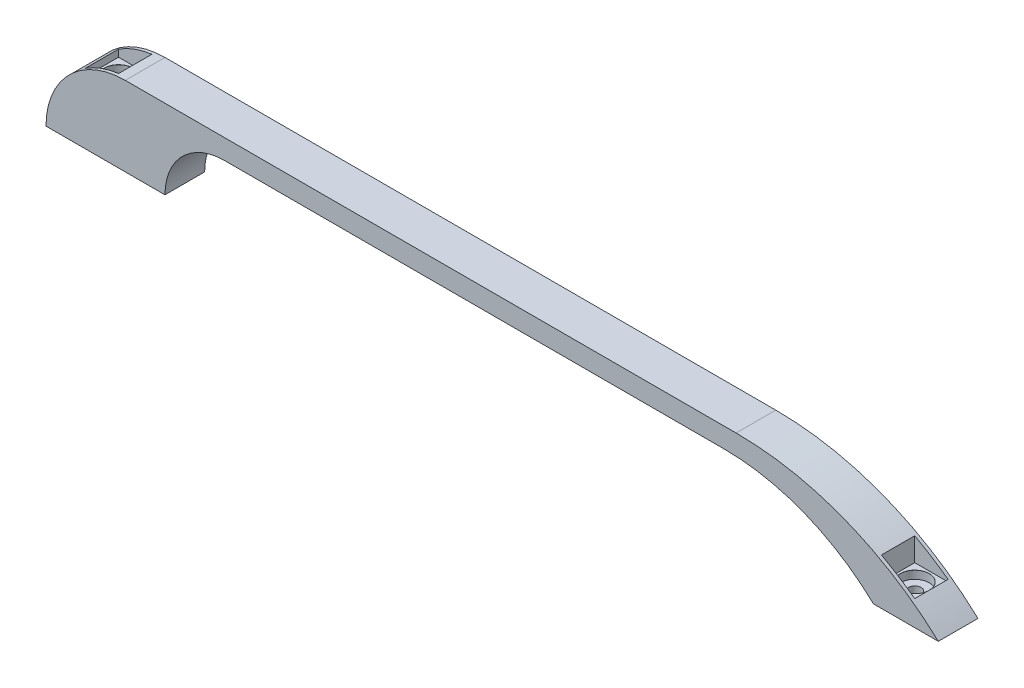
from build123d import *

# Parameters (mm, degrees)
DODANIE_WYCI_GNI_CIE2_DEPTH = 20
SZKIC28_W                   = 16.8
SZKIC28_H                   = 16.8
WYTNIJ_WYCI_GNI_CIE1_DEPTH  = 20
SZKIC29_W                   = 16.8
SZKIC29_H                   = 16.8
WYTNIJ_WYCI_GNI_CIE2_DEPTH  = 20


with BuildPart() as part:
    # Szkic1 → Dodanie-wyciągnięcie2 (new body)
    with BuildSketch(Plane.XY):
        with BuildLine():
            Line((40, 40), (348.019609728, 40))
            ThreePointArc((348.019609728, 40), (402.791865479, 29.642400438), (450, 0))
            Line((450, 0), (417.280680948, 0))
            ThreePointArc((417.280680948, 0), (382.503671889, 22.185117958), (342, 30))
            Line((342, 30), (116.308192204, 30))
            Line((116.308192204, 30), (90, 30))
            ThreePointArc((90, 30), (68.786796564, 21.213203436), (60, 0))
            Line((60, 0), (0, 0))
            ThreePointArc((0, 0), (11.715728753, 28.284271247), (40, 40))
        make_face()
    extrude(amount=DODANIE_WYCI_GNI_CIE2_DEPTH)

    # Szkic28 → Wytnij-wyciągnięcie1 (cut)
    with BuildSketch(Plane(origin=(0, 30, 0), x_dir=(1, 0, 0), z_dir=(0, 1, 0))):
        with Locations((26.6, -10)):
            Rectangle(SZKIC28_W, SZKIC28_H)
    extrude(amount=WYTNIJ_WYCI_GNI_CIE1_DEPTH, mode=Mode.SUBTRACT)

    # Szkic29 → Wytnij-wyciągnięcie2 (cut)
    with BuildSketch(Plane(origin=(0, 10, 0), x_dir=(1, 0, 0), z_dir=(0, 1, 0))):
        with Locations((428.1, -10)):
            Rectangle(SZKIC29_W, SZKIC29_H)
    extrude(amount=WYTNIJ_WYCI_GNI_CIE2_DEPTH, mode=Mode.SUBTRACT)

    # Szkic32 → Pog_bienie walcowe pod M6 wkr_t z _bem s (revolve, cut)
    with BuildSketch(Plane(origin=(428.1, 10, 10), x_dir=(0, 0, 1), z_dir=(1, 0, 0))):
        Polygon((0, 0), (0, 26.922753981), (3.2, 25), (3.2, 4), (7.2735, 4), (7.2735, 0.025), (7.2985, 0), align=None)
    revolve(axis=Axis((428.1, 16.35, 10), (0, -1, 0)), mode=Mode.SUBTRACT)

    # Szkic34 → Pog_bienie walcowe pod M6 wkr_t z _b 2 (revolve, cut)
    with BuildSketch(Plane(origin=(26.6, 30, 10), x_dir=(0, 0, 1), z_dir=(1, 0, 0))):
        Polygon((0, 0), (0, 41.922753981), (3.2, 40), (3.2, 4), (7.2735, 4), (7.2735, 0.025), (7.2985, 0), align=None)
    revolve(axis=Axis((26.6, 36.35, 10), (0, -1, 0)), mode=Mode.SUBTRACT)


solid = part.part
